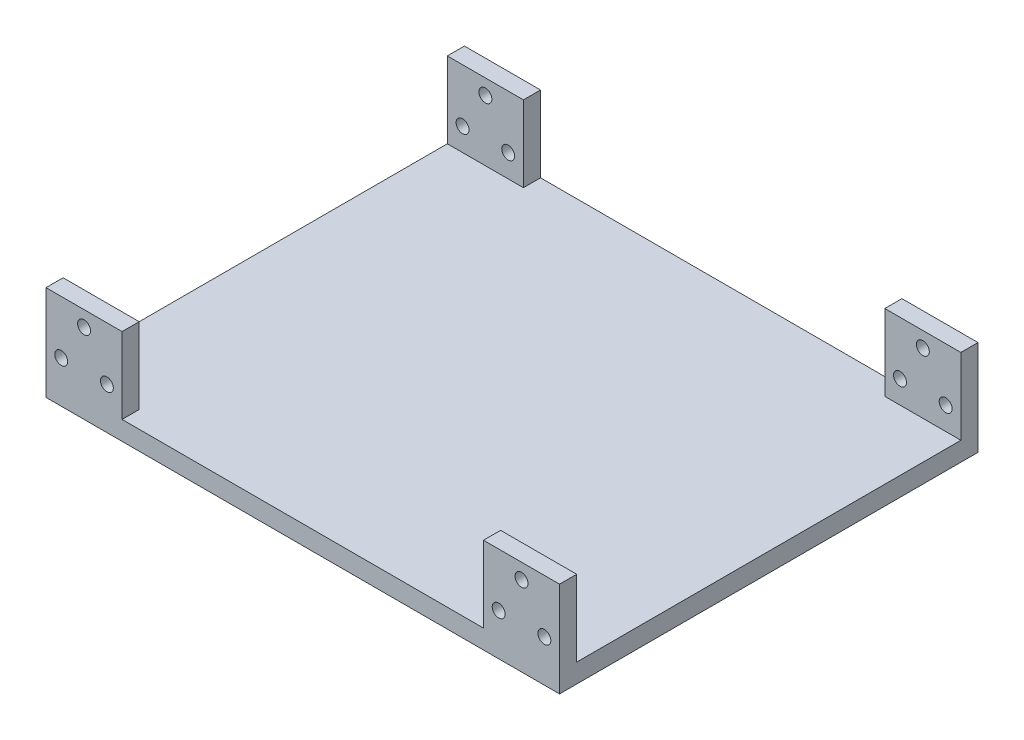
from build123d import *

# Parameters (mm, degrees)
SKETCH_1_W          = 135
SKETCH_1_H          = 110
EXTRUDE_1_DEPTH     = 5
SKETCH_2_W          = 20
SKETCH_2_H          = 4.5
EXTRUDE_2_DEPTH     = 20
SKETCH_3_R          = 1.7
CUT_EXTRUDE_1_DEPTH = 130
SKETCH_4_R          = 45.1
SKETCH_4_R_2        = 32.45
CUT_EXTRUDE_2_DEPTH = 2


with BuildPart() as part:
    # 草图1 → 凸台-拉伸1 (new body)
    with BuildSketch(Plane(origin=(0, 0, 0), x_dir=(1, 0, 0), z_dir=(0, 1, 0))):
        Rectangle(SKETCH_1_W, SKETCH_1_H)
    extrude(amount=EXTRUDE_1_DEPTH)

    # 草图2 → 凸台-拉伸2 (add)
    with BuildSketch(Plane(origin=(0, 5, 0), x_dir=(1, 0, 0), z_dir=(0, 1, 0))):
        with Locations((57.5, 52.75)):
            Rectangle(SKETCH_2_W, SKETCH_2_H)
        with Locations((-57.5, 52.75)):
            Rectangle(SKETCH_2_W, SKETCH_2_H)
        with Locations((-57.5, -52.75)):
            Rectangle(SKETCH_2_W, SKETCH_2_H)
        with Locations((57.5, -52.75)):
            Rectangle(SKETCH_2_W, SKETCH_2_H)
    extrude(amount=EXTRUDE_2_DEPTH)

    # 草图3 → 切除-拉伸1 (cut)
    with BuildSketch(Plane(origin=(0, 0, -55), x_dir=(-1, 0, 0), z_dir=(0, 0, -1))):
        with Locations((57.5, 21)):
            Circle(SKETCH_3_R)
        with Locations((51.5, 11)):
            Circle(SKETCH_3_R)
        with Locations((63.5, 11)):
            Circle(SKETCH_3_R)
        with Locations((-51.5, 11)):
            Circle(SKETCH_3_R)
        with Locations((-63.5, 11)):
            Circle(SKETCH_3_R)
        with Locations((-57.5, 21)):
            Circle(SKETCH_3_R)
    extrude(amount=-CUT_EXTRUDE_1_DEPTH, mode=Mode.SUBTRACT)

    # 草图4 → 切除-拉伸2 (cut)
    with BuildSketch(Plane.XZ):
        with Locations(Location((0, 0, 0), (0, 0, 270))):
            Circle(SKETCH_4_R)
        with Locations(Location((0, 0, 0), (0, 0, 270))):
            Circle(SKETCH_4_R_2, mode=Mode.SUBTRACT)
    extrude(amount=-CUT_EXTRUDE_2_DEPTH, mode=Mode.SUBTRACT)


solid = part.part
